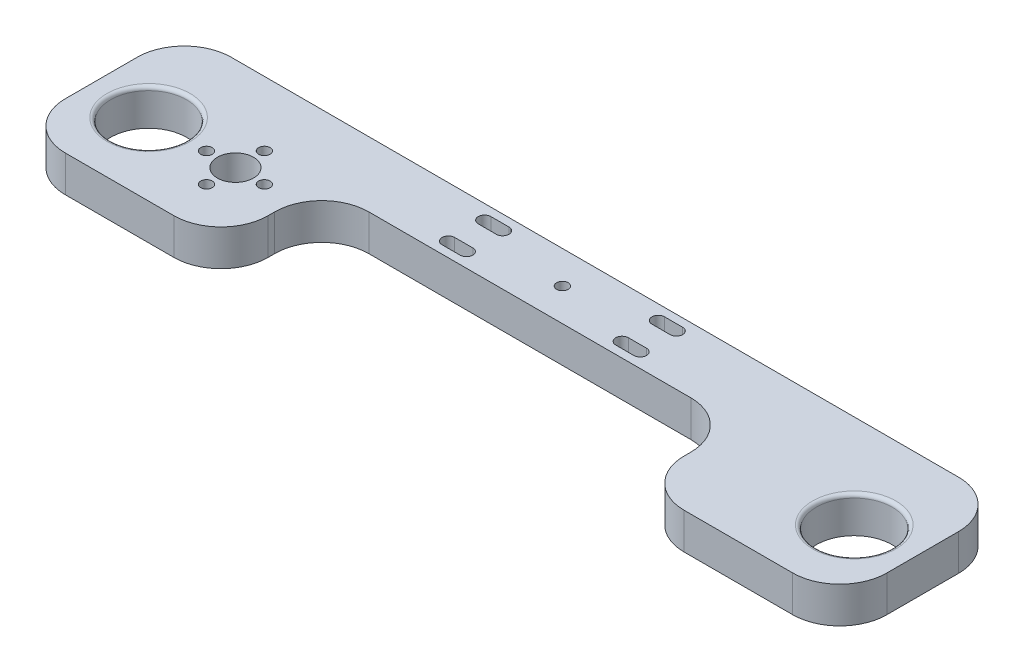
from build123d import *

# Parameters (mm, degrees)
SKETCH1_R           = 10.5
BOSS_EXTRUDE1_DEPTH = 10
FILLET1_R           = 13
SKETCH8_R           = 1.6
SKETCH8_R_2         = 5
CUT_EXTRUDE5_DEPTH  = 122.553128346
SKETCH4_R           = 1.6
CUT_EXTRUDE6_DEPTH  = 10
FILLET2_R           = 1


with BuildPart() as part:
    # Sketch1 → Boss-Extrude1 (new body)
    with BuildSketch(Plane(origin=(0, 0, 0), x_dir=(1, 0, 0), z_dir=(0, 1, 0))):
        Polygon((108.646998451, -20), (108.646998451, 25.840472806), (-118.353001549, 25.840472806), (-118.353001549, -20), (-62.353001549, -20), (-62.353001549, 7.840472806), (52.646998451, 7.840472806), (52.646998451, -20), align=None)
        with Locations(Location((92.646998451, 0, 0), (0, 0, 270))):
            Circle(SKETCH1_R, mode=Mode.SUBTRACT)
        with Locations(Location((-102.353001549, 0, 0), (0, 0, 270))):
            Circle(SKETCH1_R, mode=Mode.SUBTRACT)
    extrude(amount=BOSS_EXTRUDE1_DEPTH)

    # Fillet1
    fillet1_edges = [part.edges().sort_by_distance(p)[0] for p in [
        (108.646998451, 5, -25.840472806),
        (108.646998451, 5, 20),
        (52.646998451, 5, 20),
        (52.646998451, 5, -7.840472806),
        (-62.353001549, 5, -7.840472806),
        (-62.353001549, 5, 20),
        (-118.353001549, 5, 20),
        (-118.353001549, 5, -25.840472806),
    ]]
    fillet(fillet1_edges, radius=FILLET1_R)

    # Sketch8 → Cut-Extrude5 (cut, through all)
    with BuildSketch(Plane(origin=(0, 10, 0), x_dir=(1, 0, 0), z_dir=(0, 1, 0))):
        with Locations(Location((-86.353001549, 0, 0), (0, 0, 90))):
            Circle(SKETCH8_R)
        with Locations(Location((-78.353001549, 0, 0), (0, 0, 90))):
            Circle(SKETCH8_R_2)
        with Locations(Location((-78.353001549, -8, 0), (0, 0, 90))):
            Circle(SKETCH8_R)
        with Locations(Location((-70.353001549, 0, 0), (0, 0, 90))):
            Circle(SKETCH8_R)
        with Locations(Location((-78.353001549, 8, 0), (0, 0, 90))):
            Circle(SKETCH8_R)
        with BuildLine():
            Line((-31.353001549, 23.590472806), (-26.353001549, 23.590472806))
            ThreePointArc((-26.353001549, 23.590472806), (-24.603001549, 21.840472806), (-26.353001549, 20.090472806))
            Line((-26.353001549, 20.090472806), (-31.353001549, 20.090472806))
            ThreePointArc((-31.353001549, 20.090472806), (-33.103001549, 21.840472806), (-31.353001549, 23.590472806))
        make_face()
        with BuildLine():
            Line((-31.353001549, 13.590472806), (-26.353001549, 13.590472806))
            ThreePointArc((-26.353001549, 13.590472806), (-24.603001549, 11.840472806), (-26.353001549, 10.090472806))
            Line((-26.353001549, 10.090472806), (-31.353001549, 10.090472806))
            ThreePointArc((-31.353001549, 10.090472806), (-33.103001549, 11.840472806), (-31.353001549, 13.590472806))
        make_face()
        with BuildLine():
            Line((21.646998451, 13.590472806), (16.646998451, 13.590472806))
            ThreePointArc((16.646998451, 13.590472806), (14.896998451, 11.840472806), (16.646998451, 10.090472806))
            Line((16.646998451, 10.090472806), (21.646998451, 10.090472806))
            ThreePointArc((21.646998451, 10.090472806), (23.396998451, 11.840472806), (21.646998451, 13.590472806))
        make_face()
        with BuildLine():
            Line((21.646998451, 23.590472806), (16.646998451, 23.590472806))
            ThreePointArc((16.646998451, 23.590472806), (14.896998451, 21.840472806), (16.646998451, 20.090472806))
            Line((16.646998451, 20.090472806), (21.646998451, 20.090472806))
            ThreePointArc((21.646998451, 20.090472806), (23.396998451, 21.840472806), (21.646998451, 23.590472806))
        make_face()
    extrude(amount=-CUT_EXTRUDE5_DEPTH, mode=Mode.SUBTRACT)

    # Sketch4 → Cut-Extrude6 (cut)
    with BuildSketch(Plane(origin=(0, 10, 0), x_dir=(1, 0, 0), z_dir=(0, 1, 0))):
        with Locations(Location((-4.853001549, 16.840472806, 0), (0, 0, 270))):
            Circle(SKETCH4_R)
    extrude(amount=-CUT_EXTRUDE6_DEPTH, mode=Mode.SUBTRACT)

    # Fillet2
    fillet2_edges = [part.edges().sort_by_distance(p)[0] for p in [
        (92.646998451, 10, -10.5),
        (-102.353001549, 10, -10.5),
    ]]
    fillet(fillet2_edges, radius=FILLET2_R)


solid = part.part
